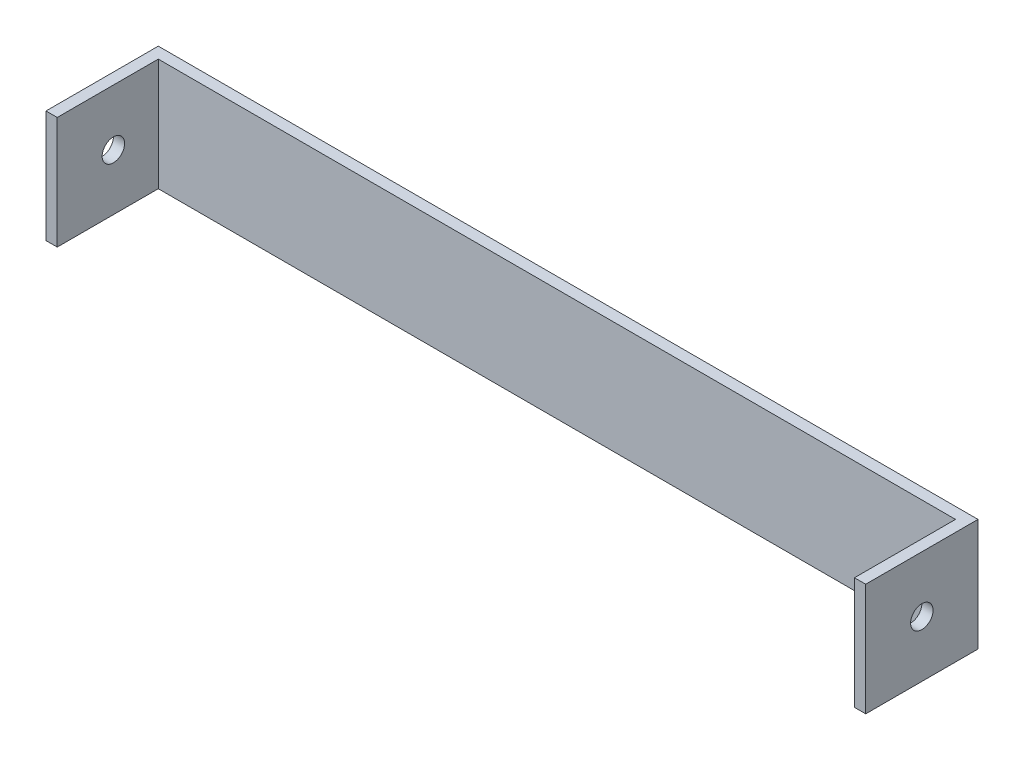
from build123d import *

# Parameters (mm, degrees)
SKETCH1_W               = 146
SKETCH1_H               = 20
BOSS_EXTRUDE1_DEPTH     = 2
SKETCH2_W               = 2
SKETCH2_H               = 20
BOSS_EXTRUDE2_DEPTH     = 18
CUT_EXTRUDE1_DEPTH      = 148.702403501
CUT_EXTRUDE1_DEPTH_BACK = 148.702403501
SKETCH3_R               = 2


with BuildPart() as part:
    # Sketch1 → Boss-Extrude1 (new body)
    with BuildSketch(Plane.XY):
        Rectangle(SKETCH1_W, SKETCH1_H)
    extrude(amount=BOSS_EXTRUDE1_DEPTH)

    # Sketch2 → Boss-Extrude2 (add)
    with BuildSketch(Plane.XY.offset(2)):
        with Locations((72, 0)):
            Rectangle(SKETCH2_W, SKETCH2_H)
        with Locations((-72, 0)):
            Rectangle(SKETCH2_W, SKETCH2_H)
    extrude(amount=BOSS_EXTRUDE2_DEPTH)

    # Sketch3 → Cut-Extrude1 (cut, two sides: drawn at the far end of the back side and taken through both)
    with BuildSketch(Plane.ZY.offset(73).offset(-CUT_EXTRUDE1_DEPTH_BACK)):
        with Locations((10, 0)):
            Circle(SKETCH3_R)
    extrude(amount=CUT_EXTRUDE1_DEPTH + CUT_EXTRUDE1_DEPTH_BACK, mode=Mode.SUBTRACT)


solid = part.part
